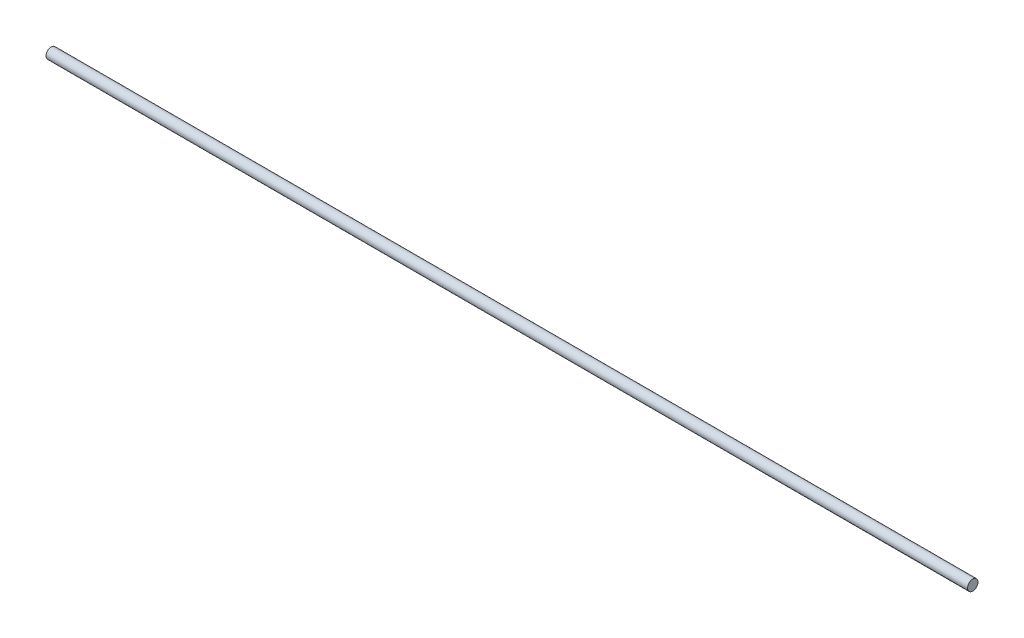
from build123d import *

# Parameters (mm, degrees)
SKETCH1_R           = 4
BOSS_EXTRUDE1_DEPTH = 705


with BuildPart() as part:
    # Sketch1 → Boss-Extrude1 (new body)
    with BuildSketch(Plane(origin=(0, 0, 0), x_dir=(0, 0, -1), z_dir=(1, 0, 0))):
        Circle(SKETCH1_R)
    extrude(amount=BOSS_EXTRUDE1_DEPTH)


solid = part.part
